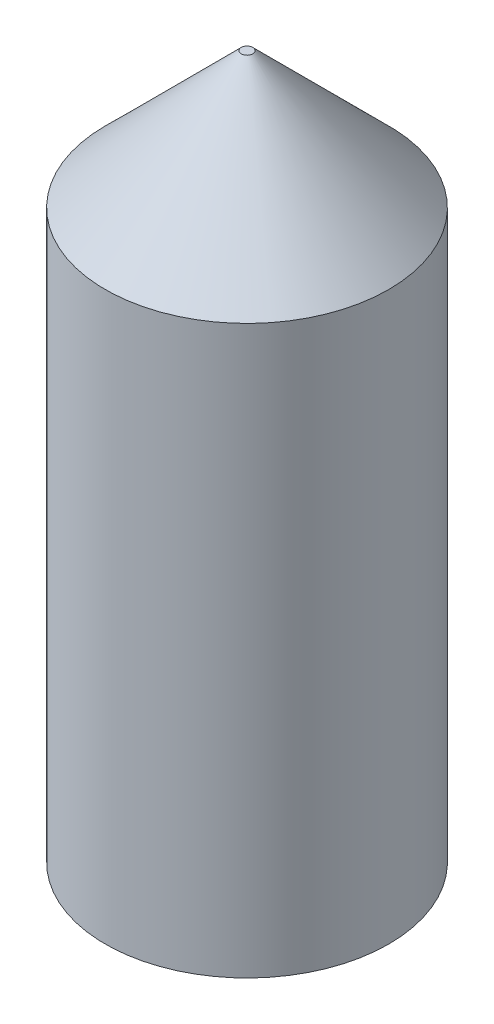
from build123d import *

# Parameters (mm, degrees)
SKETCH2_R           = 2.5
BOSS_EXTRUDE1_DEPTH = 10


with BuildPart() as part:
    # Sketch1 → Revolve1 (revolve)
    with BuildSketch(Plane.XY):
        Polygon((2.5, 0), (0, 0), (0, 2.4), (0.1, 2.4), align=None)
    revolve(axis=Axis((0, -76.093098657, 0), (0, 1, 0)))

    # Sketch2 → Boss-Extrude1 (add)
    with BuildSketch(Plane.XZ):
        Circle(SKETCH2_R)
    extrude(amount=BOSS_EXTRUDE1_DEPTH)


solid = part.part
